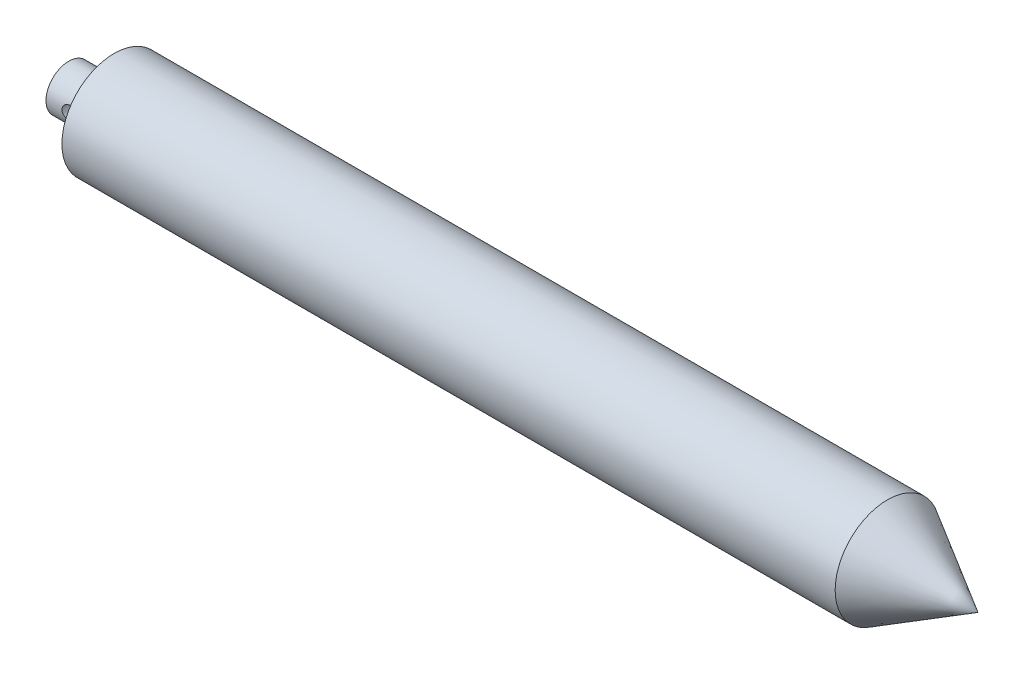
from build123d import *

# Parameters (mm, degrees)
POSI_O_DO_FURO_R      = 1.5
FURO_3_PASSANTE_DEPTH = 202.008706279


with BuildPart() as part:
    # Sketch1 → Corpo (revolve)
    with BuildSketch(Plane.XY, mode=Mode.PRIVATE) as corpo_sk:
        Polygon((0, 0), (0, 5), (10, 5), (10, 11.5), (180.081415713, 11.5), (200, 0), align=None)
    revolve(corpo_sk.sketch.rotate(Axis((0, 0, 0), (1, 0, 0)), 90), axis=Axis((0, 0, 0), (1, 0, 0)))

    # Posição do Furo → Furo Ø3 Passante (cut, through all)
    with BuildSketch(Plane.XY.offset(5)):
        with Locations((5, 0)):
            Circle(POSI_O_DO_FURO_R)
    extrude(amount=-FURO_3_PASSANTE_DEPTH, mode=Mode.SUBTRACT)


solid = part.part
